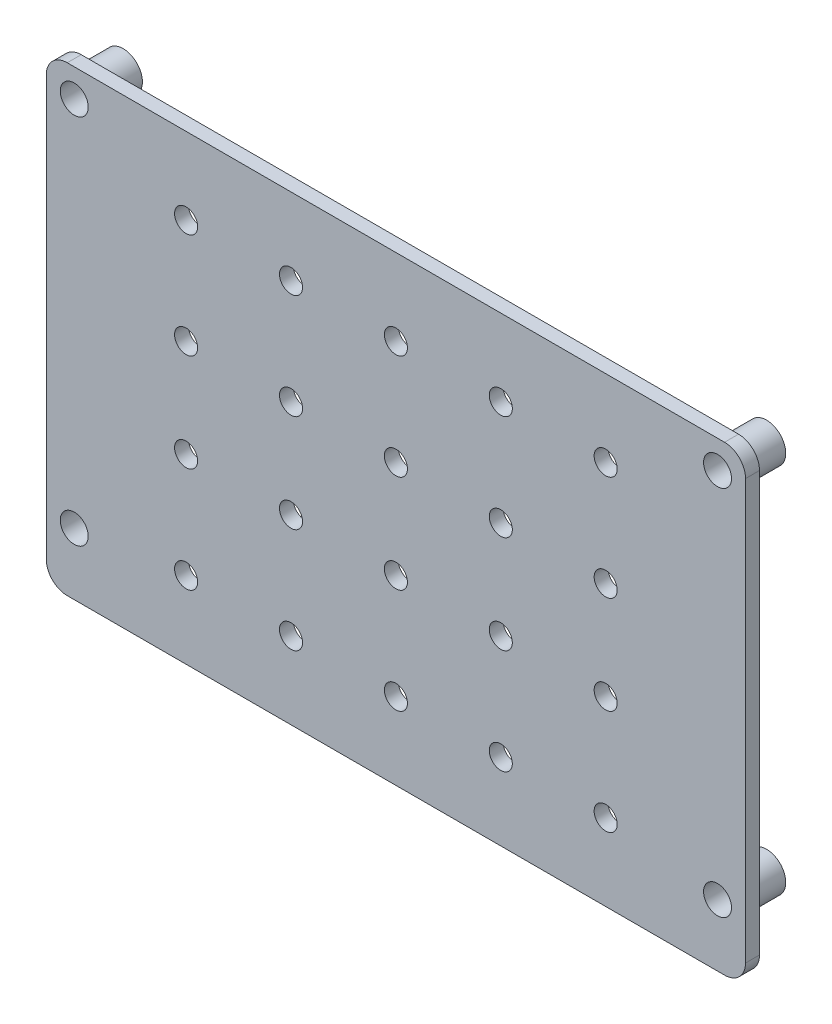
from build123d import *
from build123d.topology import SkipClean

# Parameters (mm, degrees)
SKETCH1_W               = 100
SKETCH1_H               = 66
SKETCH1_R               = 2
BOSS_EXTRUDE1_DEPTH     = 2
FILLET1_R               = 3
CUT_EXTRUDE1_REACH      = 61.942
SKETCH2_R               = 1.65
LPATTERN1_COUNT         = 3
LPATTERN1_PITCH         = 15
LPATTERN1_COL_COUNT     = 3
LPATTERN1_COL_PITCH     = 15
MIRROR1_COPY_1_REACH    = 61.942
MIRROR1_COPY_1_SKETCH_R = 1.65
MIRROR1_COPY_2_REACH    = 61.942
MIRROR1_COPY_2_SKETCH_R = 1.65
MIRROR1_COPY_3_REACH    = 61.942
MIRROR1_COPY_3_SKETCH_R = 1.65
MIRROR1_COPY_4_REACH    = 61.942
MIRROR1_COPY_4_SKETCH_R = 1.65
BOSS_EXTRUDE2_START     = 5
SKETCH4_R               = 2.75
SKETCH4_R_2             = 2
BOSS_EXTRUDE2_DEPTH     = 5


with BuildPart() as part:
    # Sketch1 → Boss-Extrude1 (new body)
    with BuildSketch(Plane.XY):
        Rectangle(SKETCH1_W, SKETCH1_H)
        with Locations((-46, 29)):
            Circle(SKETCH1_R, mode=Mode.SUBTRACT)
        with Locations((46, 29)):
            Circle(SKETCH1_R, mode=Mode.SUBTRACT)
        with Locations((-46, -24.15)):
            Circle(SKETCH1_R, mode=Mode.SUBTRACT)
        with Locations((46, -24.15)):
            Circle(SKETCH1_R, mode=Mode.SUBTRACT)
    extrude(amount=BOSS_EXTRUDE1_DEPTH)

    # Fillet1
    fillet1_edges = [part.edges().sort_by_distance(p)[0] for p in [
        (-50, 33, 1),
        (50, 33, 1),
        (50, -33, 1),
        (-50, -33, 1),
    ]]
    fillet(fillet1_edges, radius=FILLET1_R)

    # Sketch2 → Cut-Extrude1 (cut, up to next)
    with BuildSketch(Plane.XY.offset(2), mode=Mode.PRIVATE) as cut_extrude1_sk1:
        with Locations((0, -22)):
            Circle(SKETCH2_R)
    cut_extrude1_tool1 = extrude(cut_extrude1_sk1.sketch, amount=-CUT_EXTRUDE1_REACH, mode=Mode.PRIVATE) & part.part
    # Sketch2 → Cut-Extrude1 (cut, up to next)
    with BuildSketch(Plane.XY.offset(2), mode=Mode.PRIVATE) as cut_extrude1_sk2:
        with Locations((0, -7)):
            Circle(SKETCH2_R)
    cut_extrude1_tool2 = extrude(cut_extrude1_sk2.sketch, amount=-CUT_EXTRUDE1_REACH, mode=Mode.PRIVATE) & part.part
    cut_extrude1_1 = cut_extrude1_tool1.solids().sort_by_distance((0, -22, 2))[0]
    add(cut_extrude1_1, mode=Mode.SUBTRACT)
    cut_extrude1_2 = cut_extrude1_tool2.solids().sort_by_distance((0, -7, 2))[0]
    add(cut_extrude1_2, mode=Mode.SUBTRACT)
    cut_extrude1 = cut_extrude1_1 + cut_extrude1_2  # Cut-Extrude1 as one shape, for the pattern or mirror that repeats it

    # LPattern1: Cut-Extrude1 ×3
    with Locations(*[(-i * LPATTERN1_PITCH, 0, 0) for i in range(1, LPATTERN1_COUNT)]):
        add(cut_extrude1, mode=Mode.SUBTRACT)

    # LPattern1 col: Cut-Extrude1 ×3
    with Locations(*[(i * LPATTERN1_COL_PITCH, 0, 0) for i in range(1, LPATTERN1_COL_COUNT)]):
        add(cut_extrude1, mode=Mode.SUBTRACT)

    # Mirror1: Cut-Extrude1 across plane
    add(cut_extrude1.mirror(Plane.ZX), mode=Mode.SUBTRACT)

    # Mirror1 copy 1 sketch → Mirror1 copy 1 (cut, up to next)
    with BuildSketch(Plane(origin=(-15, 0, 2), x_dir=(1, 0, 0), z_dir=(0, 0, 1)), mode=Mode.PRIVATE) as mirror1_copy_1_sk1:
        with Locations((0, 22)):
            Circle(MIRROR1_COPY_1_SKETCH_R)
    mirror1_copy_1_tool1 = extrude(mirror1_copy_1_sk1.sketch, amount=-MIRROR1_COPY_1_REACH, mode=Mode.PRIVATE) & part.part
    # Mirror1 copy 1 sketch → Mirror1 copy 1 (cut, up to next)
    with BuildSketch(Plane(origin=(-15, 0, 2), x_dir=(1, 0, 0), z_dir=(0, 0, 1)), mode=Mode.PRIVATE) as mirror1_copy_1_sk2:
        with Locations((0, 7)):
            Circle(MIRROR1_COPY_1_SKETCH_R)
    mirror1_copy_1_tool2 = extrude(mirror1_copy_1_sk2.sketch, amount=-MIRROR1_COPY_1_REACH, mode=Mode.PRIVATE) & part.part
    add(mirror1_copy_1_tool1.solids().sort_by_distance((-15, 22, 2))[0], mode=Mode.SUBTRACT)
    add(mirror1_copy_1_tool2.solids().sort_by_distance((-15, 7, 2))[0], mode=Mode.SUBTRACT)

    # Mirror1 copy 2 sketch → Mirror1 copy 2 (cut, up to next)
    with BuildSketch(Plane(origin=(-30, 0, 2), x_dir=(1, 0, 0), z_dir=(0, 0, 1)), mode=Mode.PRIVATE) as mirror1_copy_2_sk1:
        with Locations((0, 22)):
            Circle(MIRROR1_COPY_2_SKETCH_R)
    mirror1_copy_2_tool1 = extrude(mirror1_copy_2_sk1.sketch, amount=-MIRROR1_COPY_2_REACH, mode=Mode.PRIVATE) & part.part
    # Mirror1 copy 2 sketch → Mirror1 copy 2 (cut, up to next)
    with BuildSketch(Plane(origin=(-30, 0, 2), x_dir=(1, 0, 0), z_dir=(0, 0, 1)), mode=Mode.PRIVATE) as mirror1_copy_2_sk2:
        with Locations((0, 7)):
            Circle(MIRROR1_COPY_2_SKETCH_R)
    mirror1_copy_2_tool2 = extrude(mirror1_copy_2_sk2.sketch, amount=-MIRROR1_COPY_2_REACH, mode=Mode.PRIVATE) & part.part
    add(mirror1_copy_2_tool1.solids().sort_by_distance((-30, 22, 2))[0], mode=Mode.SUBTRACT)
    add(mirror1_copy_2_tool2.solids().sort_by_distance((-30, 7, 2))[0], mode=Mode.SUBTRACT)

    # Mirror1 copy 3 sketch → Mirror1 copy 3 (cut, up to next)
    with BuildSketch(Plane(origin=(15, 0, 2), x_dir=(1, 0, 0), z_dir=(0, 0, 1)), mode=Mode.PRIVATE) as mirror1_copy_3_sk1:
        with Locations((0, 22)):
            Circle(MIRROR1_COPY_3_SKETCH_R)
    mirror1_copy_3_tool1 = extrude(mirror1_copy_3_sk1.sketch, amount=-MIRROR1_COPY_3_REACH, mode=Mode.PRIVATE) & part.part
    # Mirror1 copy 3 sketch → Mirror1 copy 3 (cut, up to next)
    with BuildSketch(Plane(origin=(15, 0, 2), x_dir=(1, 0, 0), z_dir=(0, 0, 1)), mode=Mode.PRIVATE) as mirror1_copy_3_sk2:
        with Locations((0, 7)):
            Circle(MIRROR1_COPY_3_SKETCH_R)
    mirror1_copy_3_tool2 = extrude(mirror1_copy_3_sk2.sketch, amount=-MIRROR1_COPY_3_REACH, mode=Mode.PRIVATE) & part.part
    add(mirror1_copy_3_tool1.solids().sort_by_distance((15, 22, 2))[0], mode=Mode.SUBTRACT)
    add(mirror1_copy_3_tool2.solids().sort_by_distance((15, 7, 2))[0], mode=Mode.SUBTRACT)

    # Mirror1 copy 4 sketch → Mirror1 copy 4 (cut, up to next)
    with BuildSketch(Plane(origin=(30, 0, 2), x_dir=(1, 0, 0), z_dir=(0, 0, 1)), mode=Mode.PRIVATE) as mirror1_copy_4_sk1:
        with Locations((0, 22)):
            Circle(MIRROR1_COPY_4_SKETCH_R)
    mirror1_copy_4_tool1 = extrude(mirror1_copy_4_sk1.sketch, amount=-MIRROR1_COPY_4_REACH, mode=Mode.PRIVATE) & part.part
    # Mirror1 copy 4 sketch → Mirror1 copy 4 (cut, up to next)
    with BuildSketch(Plane(origin=(30, 0, 2), x_dir=(1, 0, 0), z_dir=(0, 0, 1)), mode=Mode.PRIVATE) as mirror1_copy_4_sk2:
        with Locations((0, 7)):
            Circle(MIRROR1_COPY_4_SKETCH_R)
    mirror1_copy_4_tool2 = extrude(mirror1_copy_4_sk2.sketch, amount=-MIRROR1_COPY_4_REACH, mode=Mode.PRIVATE) & part.part
    add(mirror1_copy_4_tool1.solids().sort_by_distance((30, 22, 2))[0], mode=Mode.SUBTRACT)
    add(mirror1_copy_4_tool2.solids().sort_by_distance((30, 7, 2))[0], mode=Mode.SUBTRACT)

    # Sketch4 → Boss-Extrude2 (add)
    # profile 1 of 4: a face of its own
    with SkipClean():  # the faces are left unmerged after this step: merging them gives an invalid solid
        with BuildSketch(Plane(origin=(0, 0, 0), x_dir=(-1, 0, 0), z_dir=(0, 0, -1)).offset(BOSS_EXTRUDE2_START)):
            with Locations(Location((-46, 29, 0), (0, 0, 180))):
                Circle(SKETCH4_R)
            with Locations((-46, 29)):
                Circle(SKETCH4_R_2, mode=Mode.SUBTRACT)
        # profile 2 of 4: a face of its own
        with BuildSketch(Plane(origin=(0, 0, 0), x_dir=(-1, 0, 0), z_dir=(0, 0, -1)).offset(BOSS_EXTRUDE2_START)):
            with Locations(Location((-46, -24.15, 0), (0, 0, 180))):
                Circle(SKETCH4_R)
            with Locations((-46, -24.15)):
                Circle(SKETCH4_R_2, mode=Mode.SUBTRACT)
        # profile 3 of 4: a face of its own
        with BuildSketch(Plane(origin=(0, 0, 0), x_dir=(-1, 0, 0), z_dir=(0, 0, -1)).offset(BOSS_EXTRUDE2_START)):
            with Locations(Location((46, -24.15, 0), (0, 0, 180))):
                Circle(SKETCH4_R)
            with Locations((46, -24.15)):
                Circle(SKETCH4_R_2, mode=Mode.SUBTRACT)
        # profile 4 of 4: a face of its own
        with BuildSketch(Plane(origin=(0, 0, 0), x_dir=(-1, 0, 0), z_dir=(0, 0, -1)).offset(BOSS_EXTRUDE2_START)):
            with Locations(Location((46, 29, 0), (0, 0, 180))):
                Circle(SKETCH4_R)
            with Locations((46, 29)):
                Circle(SKETCH4_R_2, mode=Mode.SUBTRACT)
        extrude(amount=-BOSS_EXTRUDE2_DEPTH)


solid = part.part
